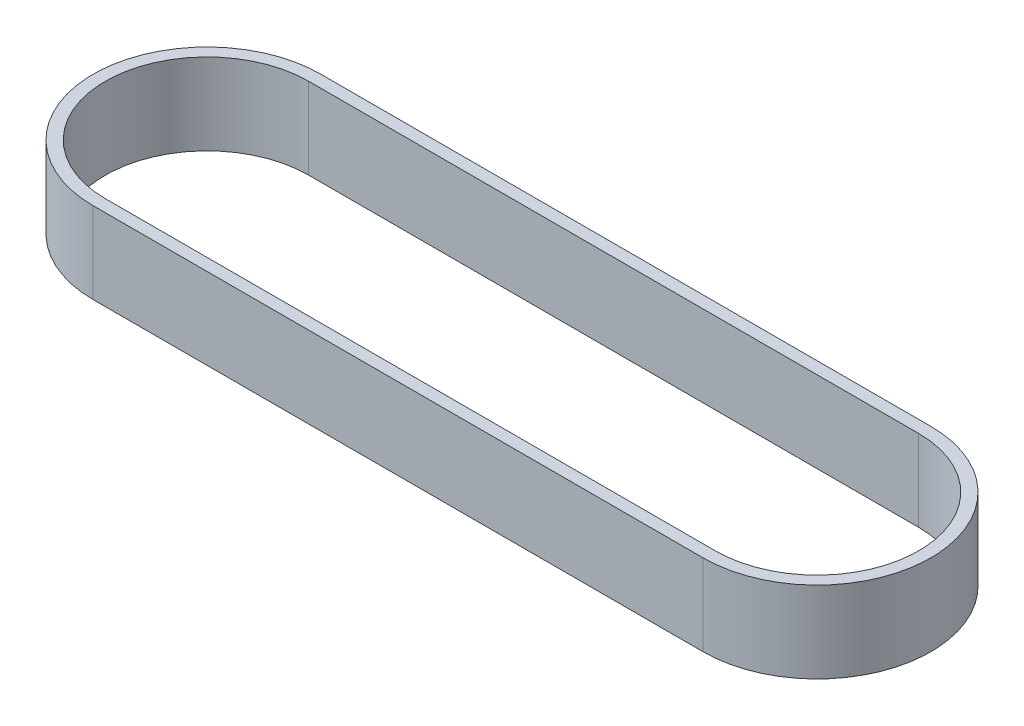
from build123d import *

# Parameters (mm, degrees)
BOSS_EXTRUDE1_DEPTH = 40


with BuildPart() as part:
    # Sketch1 → Boss-Extrude1 (new body)
    with BuildSketch(Plane(origin=(0, 0, 0), x_dir=(1, 0, 0), z_dir=(0, 1, 0))):
        with BuildLine():
            Line((-150, 56), (150, 56))
            ThreePointArc((150, 56), (206, 0), (150, -56))
            Line((150, -56), (-150, -56))
            ThreePointArc((-150, -56), (-206, 0), (-150, 56))
        make_face()
        with BuildLine():
            Line((-150, 50), (150, 50))
            ThreePointArc((150, 50), (200, 0), (150, -50))
            Line((150, -50), (-150, -50))
            ThreePointArc((-150, -50), (-200, 0), (-150, 50))
        make_face(mode=Mode.SUBTRACT)
    extrude(amount=BOSS_EXTRUDE1_DEPTH)


solid = part.part
